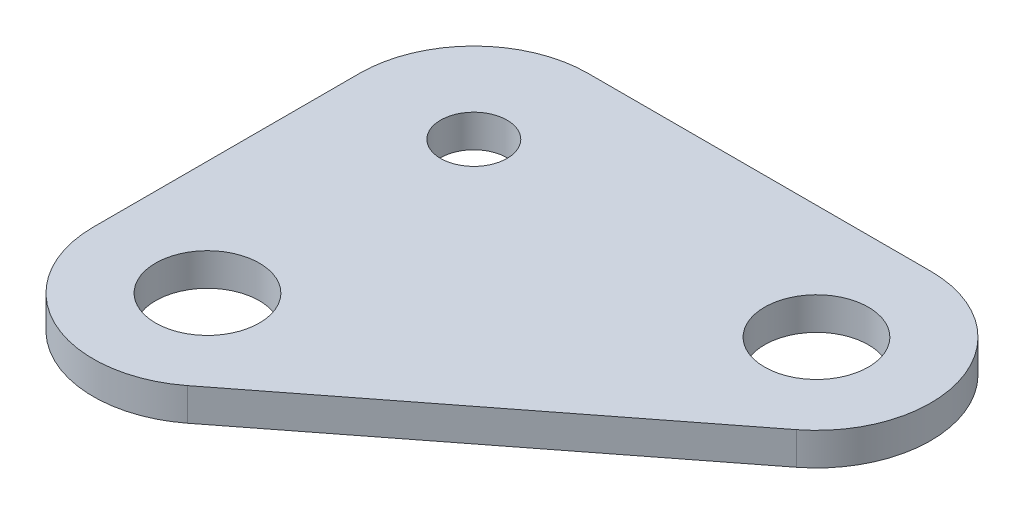
from build123d import *

# Parameters (mm, degrees)
SKETCH2_R           = 1.6
SKETCH2_R_2         = 2.5
BOSS_EXTRUDE1_DEPTH = 1.57


with BuildPart() as part:
    # Sketch2 → Boss-Extrude1 (new body)
    with BuildSketch(Plane(origin=(0, 0, 0), x_dir=(1, 0, 0), z_dir=(0, 1, 0))):
        with BuildLine():
            Line((-5.5, 0), (-5.5, 12.825))
            ThreePointArc((-5.5, 12.825), (-3.889087297, 16.714087297), (0, 18.325))
            Line((0, 18.325), (16.5, 18.325))
            ThreePointArc((16.5, 18.325), (21.702583448, 14.609131572), (19.875306686, 8.48250017))
            Line((19.875306686, 8.48250017), (3.375306686, -4.34249983))
            ThreePointArc((3.375306686, -4.34249983), (-2.417210502, -4.940353569), (-5.5, 0))
        make_face()
        with Locations(Location((0, 12.825, 0), (0, 0, 270))):
            Circle(SKETCH2_R, mode=Mode.SUBTRACT)
        with Locations(Location((16.5, 12.825, 0), (0, 0, 270))):
            Circle(SKETCH2_R_2, mode=Mode.SUBTRACT)
        with Locations(Location((0, 0, 0), (0, 0, 270))):
            Circle(SKETCH2_R_2, mode=Mode.SUBTRACT)
    extrude(amount=BOSS_EXTRUDE1_DEPTH)


solid = part.part
